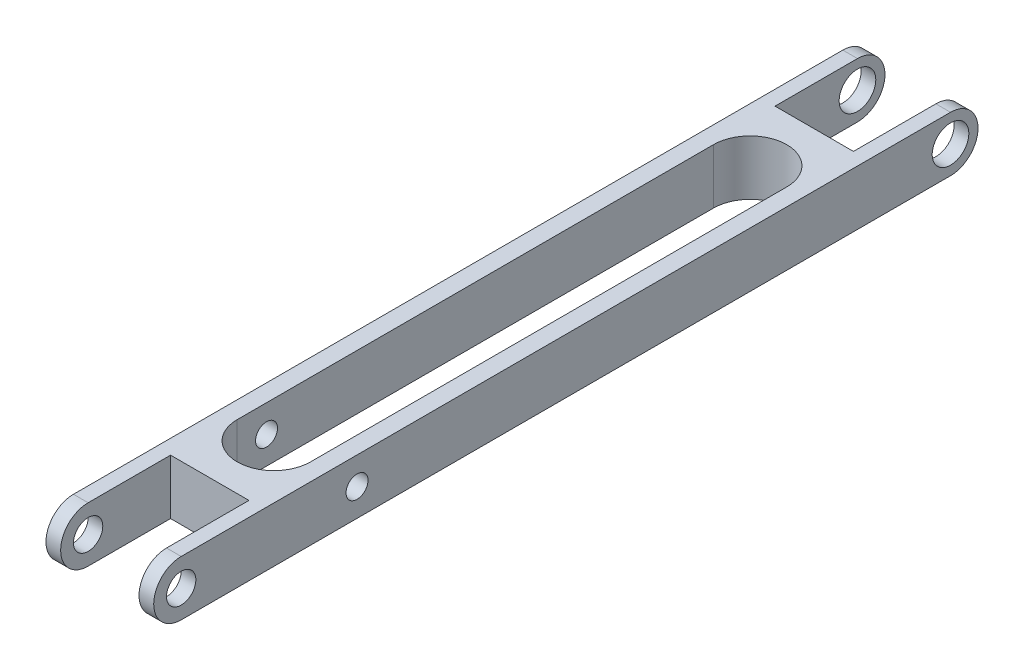
from build123d import *

# Parameters (mm, degrees)
EXTRUDE_1_DEPTH     = 29.4
SKETCH_3_W          = 21.4
SKETCH_3_H          = 30
CUT_EXTRUDE_1_DEPTH = 118.241673478
SKETCH_4_R          = 4
SKETCH_4_R_2        = 5
CUT_EXTRUDE_2_DEPTH = 117.519783728
CUT_EXTRUDE_3_DEPTH = 118.241673478
SKETCH_6_R          = 3
CUT_EXTRUDE_4_DEPTH = 117.519783728


with BuildPart() as part:
    # 草图2 → 凸台-拉伸1 (new body)
    with BuildSketch(Plane(origin=(0, 0, 0), x_dir=(0, 0, -1), z_dir=(1, 0, 0))):
        with BuildLine():
            Line((-105, -7.5), (105, -7.5))
            ThreePointArc((105, -7.5), (112.5, 0), (105, 7.5))
            Line((105, 7.5), (-105, 7.5))
            ThreePointArc((-105, 7.5), (-112.5, 0), (-105, -7.5))
        make_face()
    extrude(amount=EXTRUDE_1_DEPTH)

    # 草图3 → 切除-拉伸1 (cut, through all)
    with BuildSketch(Plane(origin=(0, 7.5, 0), x_dir=(1, 0, 0), z_dir=(0, 1, 0))):
        with Locations((14.7, -97.5)):
            Rectangle(SKETCH_3_W, SKETCH_3_H)
        with Locations((14.7, 97.5)):
            Rectangle(SKETCH_3_W, SKETCH_3_H)
    extrude(amount=-CUT_EXTRUDE_1_DEPTH, mode=Mode.SUBTRACT)

    # 草图4 → 切除-拉伸2 (cut, through all)
    with BuildSketch(Plane(origin=(29.4, 0, 0), x_dir=(0, 0, -1), z_dir=(1, 0, 0))):
        with Locations((-105, 0)):
            Circle(SKETCH_4_R)
        with Locations((105, 0)):
            Circle(SKETCH_4_R_2)
    extrude(amount=-CUT_EXTRUDE_2_DEPTH, mode=Mode.SUBTRACT)

    # 草图5 → 切除-拉伸3 (cut, through all)
    with BuildSketch(Plane.XZ.offset(7.5)):
        with BuildLine():
            Line((24.7, 65), (24.7, -65))
            ThreePointArc((24.7, -65), (14.7, -75), (4.7, -65))
            Line((4.7, -65), (4.7, 65))
            ThreePointArc((4.7, 65), (14.7, 75), (24.7, 65))
        make_face()
    extrude(amount=-CUT_EXTRUDE_3_DEPTH, mode=Mode.SUBTRACT)

    # 草图6 → 切除-拉伸4 (cut, through all)
    with BuildSketch(Plane.ZY):
        with Locations((57, 0)):
            Circle(SKETCH_6_R)
    extrude(amount=-CUT_EXTRUDE_4_DEPTH, mode=Mode.SUBTRACT)


solid = part.part
